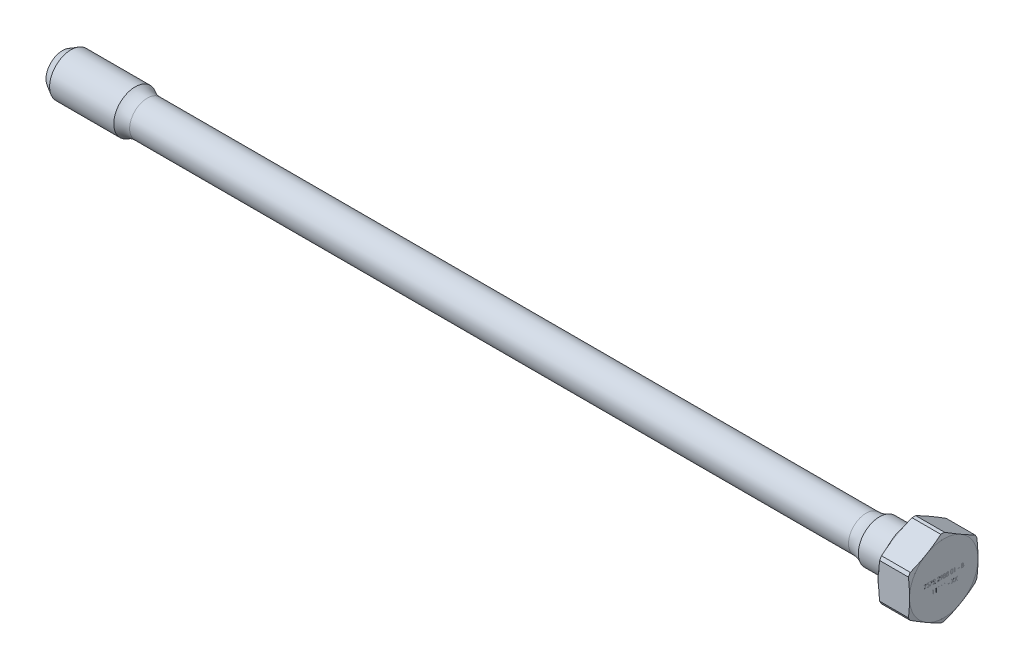
from build123d import *

# Parameters (mm, degrees)
CUT_EXTRUDE_THIN1_REACH = 414.786
SKETCH4_W               = 0.692307692
SKETCH4_H               = 0.184615385
CUT_EXTRUDE1_DEPTH      = 0.01


with BuildPart() as part:
    # Sketch1 → Revolve1 (revolve)
    with BuildSketch(Plane.XY):
        with BuildLine():
            Line((8, 0), (6.798278762, 2))
            Line((6.798278762, 2), (3.464101615, 2))
            Line((3.464101615, 2), (0, 4))
            Line((0, 4), (0, 7.690598923))
            Line((0, 7.690598923), (4, 10))
            Line((4, 10), (34, 10))
            ThreePointArc((34, 10), (36.693287386, 8.697513413), (39.651327278, 8.25))
            Line((39.651327278, 8.25), (375.706352409, 8.25))
            ThreePointArc((375.706352409, 8.25), (378.965953612, 8.682481614), (382, 9.95))
            Line((382, 9.95), (395, 9.95))
            ThreePointArc((395, 9.95), (396.414213562, 10.535786438), (397, 11.95))
            Line((397, 11.95), (397, 15.75))
            Line((397, 15.75), (397.5, 15.75))
            Line((397.5, 15.75), (397.5, 16))
            Line((397.5, 16), (398.035898385, 18))
            Line((398.035898385, 18), (411.464101615, 18))
            Line((411.464101615, 18), (412, 16))
            Line((412, 16), (412, 0))
            Line((412, 0), (8, 0))
        make_face()
    revolve(axis=Axis((412, 0, 0), (-1, 0, 0)))

    # Cut-Extrude-Thin1: up to this cone (the profile starts inside it)
    cut_extrude_thin1_end = Plane(origin=(412, 0, 0), z_dir=(1, 0, 0)).offset(-18.787186079) * Cone(3.732e-06, 1881.654948142, 504.187922789, align=(Align.CENTER, Align.CENTER, Align.MIN), mode=Mode.PRIVATE)
    # Sketch3 → Cut-Extrude-Thin1 (cut, up to the surface)
    with BuildSketch(Plane(origin=(412, 0, 0), x_dir=(0, 0, -1), z_dir=(1, 0, 0)), mode=Mode.PRIVATE) as cut_extrude_thin1_sk1:
        Polygon((0, 30.022213998), (-26, 15.011106999), (-26, -15.011106999), (0, -30.022213998), (26, -15.011106999), (26, 15.011106999), align=None)
        Polygon((0, 18.475208614), (-16, 9.237604307), (-16, -9.237604307), (0, -18.475208614), (16, -9.237604307), (16, 9.237604307), align=None, mode=Mode.SUBTRACT)
    cut_extrude_thin1_tool1 = extrude(cut_extrude_thin1_sk1.sketch, amount=-CUT_EXTRUDE_THIN1_REACH, mode=Mode.PRIVATE) & cut_extrude_thin1_end
    add(cut_extrude_thin1_tool1.solids().sort_by_distance((412, 21.828765, 12.602843))[0], mode=Mode.SUBTRACT)

    # Sketch4 → Cut-Extrude1 (cut)
    # profile 1 of 20: a face of its own
    with BuildSketch(Plane(origin=(412, 0, 0), x_dir=(0, 0, -1), z_dir=(-1, 0, 0))):
        Polygon((-9.191244791, -1.8), (-8.083552483, -1.8), (-9.02970633, 0.046153846), (-9.169249599, -0.030649038), (-8.357230368, -1.615384615), (-9.191244791, -1.615384615), align=None)
    # profile 2 of 20: a face of its own
    with BuildSketch(Plane(origin=(412, 0, 0), x_dir=(0, 0, -1), z_dir=(-1, 0, 0))):
        with BuildLine():
            Line((-7.691244791, -1.384615385), (-7.852783253, -1.384615385))
            add(Edge.make_bspline(
                [(-7.852783253, -1.384615385), (-7.848406912, -1.402734948), (-7.839851525, -1.438157212), (-7.822007059, -1.48876666), (-7.802567442, -1.536658757), (-7.779224474, -1.580936738), (-7.753762829, -1.622490459), (-7.724591143, -1.660377437), (-7.693055286, -1.695561248), (-7.658173883, -1.726785199), (-7.621593429, -1.75505946), (-7.582798481, -1.779166632), (-7.542569565, -1.799904768), (-7.500627954, -1.816989458), (-7.456848779, -1.829859728), (-7.41162783, -1.839197514), (-7.364846602, -1.845261515), (-7.333090698, -1.845853336), (-7.316965945, -1.846153846)],
                knots=[0, 0, 0, 0, 1.162005537, 2.271625781, 3.343758855, 4.383309926, 5.390229558, 6.379919256, 7.361854164, 8.333198761, 9.295911338, 10.242430842, 11.177959212, 12.116337295, 13.062827104, 14.020064771, 14.994644689, 16, 16, 16, 16], degree=3))
            add(Edge.make_bspline(
                [(-7.316965945, -1.846153846), (-7.293471963, -1.845444528), (-7.246996472, -1.844041363), (-7.178718334, -1.831228224), (-7.112875969, -1.810952442), (-7.050190071, -1.782937382), (-6.991963448, -1.748383907), (-6.940156266, -1.707259185), (-6.895470747, -1.660356687), (-6.857982209, -1.608551369), (-6.828629353, -1.553185678), (-6.806984932, -1.49620274), (-6.793808068, -1.437737726), (-6.792100353, -1.398262554), (-6.791244791, -1.378485577)],
                knots=[0, 0, 0, 0, 1.083050992, 2.142477498, 3.193116406, 4.255571735, 5.30263384, 6.308962982, 7.297363603, 8.282367274, 9.249857812, 10.179914175, 11.08814088, 12, 12, 12, 12], degree=3))
            add(Edge.make_bspline(
                [(-6.791244791, -1.378485577), (-6.791843209, -1.359453511), (-6.793014221, -1.322210712), (-6.80295727, -1.267839656), (-6.819690205, -1.216595404), (-6.84286894, -1.168262235), (-6.872873166, -1.123146603), (-6.909219124, -1.081147002), (-6.95216335, -1.04207715), (-6.984706804, -1.019695706), (-7.001461137, -1.008173077)],
                knots=[0, 0, 0, 0, 1.024540389, 2.004866551, 2.965041327, 3.920577974, 4.882998113, 5.874504559, 6.905732034, 8, 8, 8, 8], degree=3))
            add(Edge.make_bspline(
                [(-7.001461137, -1.008173077), (-6.982288971, -0.998960678), (-6.944241805, -0.980678671), (-6.892905073, -0.944255178), (-6.845591566, -0.903233283), (-6.819515849, -0.87086293), (-6.806389022, -0.854567308)],
                knots=[0, 0, 0, 0, 1.015663554, 2.015584519, 3.001021554, 4, 4, 4, 4], degree=3))
            add(Edge.make_bspline(
                [(-6.806389022, -0.854567308), (-6.797724235, -0.842710299), (-6.780536552, -0.819190449), (-6.759381213, -0.781353253), (-6.739969764, -0.743221934), (-6.7256835, -0.703297217), (-6.71335502, -0.662861556), (-6.70524329, -0.62104906), (-6.700035884, -0.578256985), (-6.699304658, -0.549294108), (-6.698937099, -0.534735577)],
                knots=[0, 0, 0, 0, 1.02516404, 2.033540309, 3.025129118, 4.011046665, 4.991655828, 5.976607087, 6.982917762, 8, 8, 8, 8], degree=3))
            add(Edge.make_bspline(
                [(-6.698937099, -0.534735577), (-6.699862156, -0.509531709), (-6.701707918, -0.459242583), (-6.718134684, -0.384924326), (-6.743758361, -0.312412067), (-6.779469204, -0.242734167), (-6.823852375, -0.177740147), (-6.876363704, -0.119420782), (-6.937059104, -0.069748369), (-7.004171387, -0.027877619), (-7.077162139, 0.005304479), (-7.154921289, 0.02921487), (-7.236988446, 0.043557751), (-7.293110464, 0.045278628), (-7.321653445, 0.046153846)],
                knots=[0, 0, 0, 0, 0.955619592, 1.906742024, 2.874954321, 3.868585453, 4.869520953, 5.854611167, 6.836527075, 7.836578462, 8.849204403, 9.870874567, 10.917152508, 12, 12, 12, 12], degree=3))
            add(Edge.make_bspline(
                [(-7.321653445, 0.046153846), (-7.340896445, 0.045703442), (-7.378760253, 0.044817197), (-7.434445589, 0.038866523), (-7.48748721, 0.027702625), (-7.538400169, 0.013662478), (-7.586416067, -0.005749598), (-7.632225568, -0.02889239), (-7.675627873, -0.056359362), (-7.716365228, -0.088196708), (-7.754394113, -0.123833855), (-7.788745677, -0.163862837), (-7.819799983, -0.207536574), (-7.847359716, -0.255247918), (-7.871540865, -0.306863238), (-7.891823049, -0.362589364), (-7.9095319, -0.421994283), (-7.917781418, -0.463380989), (-7.922014022, -0.484615385)],
                knots=[0, 0, 0, 0, 1.048603596, 2.063302207, 3.045874044, 3.999447474, 4.937100059, 5.862643889, 6.7929026, 7.7308982, 8.676022965, 9.627908155, 10.600123445, 11.591992905, 12.626222643, 13.701663232, 14.820785756, 16, 16, 16, 16], degree=3))
            Line((-7.922014022, -0.484615385), (-7.76047556, -0.484615385))
            add(Edge.make_bspline(
                [(-7.76047556, -0.484615385), (-7.756267011, -0.470755892), (-7.748081015, -0.443797975), (-7.734146805, -0.405000104), (-7.718271694, -0.369433105), (-7.701241349, -0.336836071), (-7.683355291, -0.306887978), (-7.663341901, -0.280380731), (-7.642683484, -0.256150056), (-7.627111245, -0.242498541), (-7.619489983, -0.235817308)],
                knots=[0, 0, 0, 0, 1.198163088, 2.33053128, 3.407730985, 4.417276592, 5.372219308, 6.28897303, 7.162600585, 8, 8, 8, 8], degree=3))
            add(Edge.make_bspline(
                [(-7.619489983, -0.235817308), (-7.609410618, -0.228050511), (-7.589283001, -0.212540893), (-7.556504805, -0.192691971), (-7.521911573, -0.175701768), (-7.485214821, -0.161891419), (-7.446409627, -0.151524873), (-7.405653402, -0.144063521), (-7.362879274, -0.139137869), (-7.333686768, -0.13869027), (-7.31876883, -0.138461538)],
                knots=[0, 0, 0, 0, 0.946083416, 1.889246487, 2.84504177, 3.809995578, 4.801312957, 5.829064617, 6.89060985, 8, 8, 8, 8], degree=3))
            add(Edge.make_bspline(
                [(-7.31876883, -0.138461538), (-7.301923943, -0.138777775), (-7.268985222, -0.139396147), (-7.220925908, -0.145099422), (-7.175190696, -0.153369348), (-7.132246312, -0.16630512), (-7.091508389, -0.181823716), (-7.053886315, -0.202140407), (-7.018274047, -0.225084824), (-6.985714861, -0.251773594), (-6.956361163, -0.280621266), (-6.930996325, -0.311226074), (-6.909027474, -0.342639072), (-6.891368184, -0.37559306), (-6.877398857, -0.409764787), (-6.867894862, -0.445282157), (-6.861285072, -0.481846093), (-6.860746874, -0.506701041), (-6.86047556, -0.519230769)],
                knots=[0, 0, 0, 0, 1.216990249, 2.379719373, 3.493992396, 4.571561497, 5.616923107, 6.638958652, 7.655775068, 8.674704564, 9.676001865, 10.625896028, 11.54399481, 12.441854662, 13.322657739, 14.20572845, 15.095482574, 16, 16, 16, 16], degree=3))
            add(Edge.make_bspline(
                [(-6.86047556, -0.519230769), (-6.861264215, -0.536001261), (-6.862837599, -0.569458797), (-6.874800272, -0.618700762), (-6.894653137, -0.666163542), (-6.921905899, -0.711225572), (-6.955875992, -0.752500767), (-6.994957653, -0.789446516), (-7.039984762, -0.820209536), (-7.081662308, -0.841404855), (-7.118674888, -0.855526459), (-7.150285509, -0.865428966), (-7.185706193, -0.873344661), (-7.224511334, -0.88100159), (-7.266864712, -0.887420655), (-7.312804448, -0.892796879), (-7.362349035, -0.897091944), (-7.39664728, -0.899011053), (-7.414321714, -0.9)],
                knots=[0, 0, 0, 0, 1.070440979, 2.135555593, 3.216243406, 4.345886539, 5.486149072, 6.621334998, 7.769144672, 8.957074012, 9.598644492, 10.297969361, 11.070758978, 11.915404831, 12.824182859, 13.805940418, 14.869366021, 16, 16, 16, 16], degree=3))
            Line((-7.414321714, -0.9), (-7.414321714, -1.084615385))
            add(Edge.make_bspline(
                [(-7.414321714, -1.084615385), (-7.392061204, -1.085049391), (-7.348473582, -1.085899206), (-7.284624228, -1.094060967), (-7.223755842, -1.107308659), (-7.166783973, -1.125804157), (-7.115124747, -1.148320964), (-7.069878597, -1.173531186), (-7.032673262, -1.20261518), (-7.00284239, -1.234198105), (-6.980716509, -1.268286621), (-6.96438449, -1.303654314), (-6.954724445, -1.340959147), (-6.953432595, -1.366412644), (-6.952783253, -1.379206731)],
                knots=[0, 0, 0, 0, 1.321816535, 2.58820849, 3.816448615, 5.017641336, 6.139869627, 7.160068286, 8.085608132, 8.934319198, 9.728416342, 10.48890201, 11.240453369, 12, 12, 12, 12], degree=3))
            add(Edge.make_bspline(
                [(-6.952783253, -1.379206731), (-6.952991689, -1.388608301), (-6.953406364, -1.407312278), (-6.958844809, -1.434723705), (-6.9666395, -1.461297531), (-6.977963607, -1.486723259), (-6.992609121, -1.511081715), (-7.010328011, -1.534461865), (-7.031165163, -1.557086967), (-7.054985264, -1.578458027), (-7.081569107, -1.597692359), (-7.10984972, -1.614839498), (-7.139937359, -1.629257801), (-7.171635949, -1.641209595), (-7.205116837, -1.650184395), (-7.240203888, -1.656632593), (-7.276969231, -1.660663055), (-7.302051802, -1.661243429), (-7.314802483, -1.661538462)],
                knots=[0, 0, 0, 0, 0.884246871, 1.759167212, 2.622361933, 3.489113179, 4.372562419, 5.294145153, 6.247651513, 7.265905295, 8.30305477, 9.334068495, 10.37719476, 11.441246459, 12.52060732, 13.637552802, 14.799054011, 16, 16, 16, 16], degree=3))
            add(Edge.make_bspline(
                [(-7.314802483, -1.661538462), (-7.335298304, -1.660824292), (-7.375331409, -1.659429353), (-7.433032502, -1.647168464), (-7.486618104, -1.627742351), (-7.527439525, -1.604285376), (-7.55763465, -1.581209997), (-7.579625493, -1.561358249), (-7.600826917, -1.538850432), (-7.620406961, -1.513069183), (-7.639538902, -1.484901015), (-7.658040058, -1.454190787), (-7.675316172, -1.420500664), (-7.685832426, -1.396808798), (-7.691244791, -1.384615385)],
                knots=[0, 0, 0, 0, 1.4727372, 2.876598283, 4.222346151, 5.558423782, 6.24313385, 6.953189256, 7.68715613, 8.463578749, 9.278833271, 10.135787152, 11.040551781, 12, 12, 12, 12], degree=3))
        make_face()
    # profile 3 of 20: a face of its own
    with BuildSketch(Plane(origin=(412, 0, 0), x_dir=(0, 0, -1), z_dir=(-1, 0, 0))):
        Polygon((-6.422014022, -1.8), (-5.314321714, -1.8), (-6.26047556, 0.046153846), (-6.40001883, -0.030649038), (-5.587999599, -1.615384615), (-6.422014022, -1.615384615), align=None)
    # profile 4 of 20: a face of its own
    with BuildSketch(Plane(origin=(412, 0, 0), x_dir=(0, 0, -1), z_dir=(-1, 0, 0))):
        with BuildLine():
            Line((-4.922014022, -1.246153846), (-5.083552483, -1.246153846))
            add(Edge.make_bspline(
                [(-5.083552483, -1.246153846), (-5.082499841, -1.267584694), (-5.08043248, -1.309674309), (-5.070746824, -1.371039395), (-5.056900693, -1.429701558), (-5.037277495, -1.48515788), (-5.013044561, -1.538070831), (-4.983376436, -1.58773779), (-4.948905598, -1.634651694), (-4.909695284, -1.677924309), (-4.86714848, -1.717480889), (-4.821520107, -1.752001503), (-4.773279139, -1.780834341), (-4.722843996, -1.805069006), (-4.669631382, -1.823237977), (-4.61414995, -1.836724977), (-4.55614893, -1.844838094), (-4.516631248, -1.845710272), (-4.496533253, -1.846153846)],
                knots=[0, 0, 0, 0, 1.100776268, 2.161895295, 3.184016182, 4.190939212, 5.176500551, 6.166955529, 7.155448256, 8.160289653, 9.16017456, 10.133824356, 11.091467644, 12.04088621, 13.000931625, 13.972173743, 14.968683325, 16, 16, 16, 16], degree=3))
            add(Edge.make_bspline(
                [(-4.496533253, -1.846153846), (-4.476794568, -1.845695533), (-4.438008759, -1.844794963), (-4.381425087, -1.836944817), (-4.327430693, -1.824915168), (-4.276637495, -1.807089124), (-4.228524214, -1.784721338), (-4.183686569, -1.756904065), (-4.141040342, -1.724953525), (-4.102678534, -1.687266297), (-4.067438585, -1.64705393), (-4.03706388, -1.604107459), (-4.010904945, -1.559699486), (-3.989494674, -1.51348312), (-3.973264736, -1.465307858), (-3.961239908, -1.415635572), (-3.954365866, -1.363893011), (-3.953316671, -1.328865775), (-3.952783253, -1.311057692)],
                knots=[0, 0, 0, 0, 1.111674182, 2.184400057, 3.212814286, 4.223731311, 5.211378316, 6.196328225, 7.191884489, 8.207283132, 9.220262353, 10.201199469, 11.166417575, 12.120932471, 13.06540007, 14.026332106, 14.996573967, 16, 16, 16, 16], degree=3))
            add(Edge.make_bspline(
                [(-3.952783253, -1.311057692), (-3.953655564, -1.285987963), (-3.955384878, -1.236288443), (-3.97013043, -1.163243641), (-3.99326123, -1.092563643), (-4.020777281, -1.035458466), (-4.048430798, -0.989394593), (-4.074004113, -0.951822035), (-4.103539637, -0.911145427), (-4.137472344, -0.867408528), (-4.176314782, -0.821169673), (-4.218585241, -0.771186594), (-4.266148841, -0.719039074), (-4.29938383, -0.683380978), (-4.316605368, -0.664903846)],
                knots=[0, 0, 0, 0, 1.184219417, 2.34765746, 3.508456027, 4.692825395, 5.335023057, 6.047372803, 6.840716919, 7.711366838, 8.663720231, 9.695456184, 10.805843131, 12, 12, 12, 12], degree=3))
            Line((-4.316605368, -0.664903846), (-4.766965945, -0.184615385))
            Line((-4.766965945, -0.184615385), (-3.92970633, -0.184615385))
            Line((-3.92970633, -0.184615385), (-3.92970633, 0))
            Line((-3.92970633, 0), (-5.152783253, 0))
            Line((-5.152783253, 0), (-4.45470633, -0.744951923))
            add(Edge.make_bspline(
                [(-4.45470633, -0.744951923), (-4.43770907, -0.762692942), (-4.405060814, -0.796769807), (-4.358902748, -0.846536061), (-4.317378698, -0.892650691), (-4.280461117, -0.935318042), (-4.24811963, -0.97429623), (-4.220457716, -1.009890718), (-4.197353114, -1.041796045), (-4.17286705, -1.079277089), (-4.149517964, -1.125093533), (-4.128996506, -1.180801987), (-4.116573095, -1.238276292), (-4.115075179, -1.277103964), (-4.114321714, -1.296634615)],
                knots=[0, 0, 0, 0, 1.329530082, 2.553755191, 3.672934919, 4.687409497, 5.60679272, 6.413407421, 7.126401618, 7.737995624, 8.834647426, 9.90044882, 10.943907757, 12, 12, 12, 12], degree=3))
            add(Edge.make_bspline(
                [(-4.114321714, -1.296634615), (-4.114645309, -1.308917835), (-4.115283052, -1.333125701), (-4.121018056, -1.368594904), (-4.129443914, -1.402941748), (-4.142430765, -1.43574156), (-4.158033989, -1.467639448), (-4.177968257, -1.497665618), (-4.200747891, -1.526843589), (-4.227171149, -1.554172872), (-4.256178977, -1.57921074), (-4.286828443, -1.601388366), (-4.319253951, -1.61992289), (-4.35332037, -1.635116655), (-4.388932306, -1.647035431), (-4.426158752, -1.655294127), (-4.464896816, -1.660479405), (-4.491348328, -1.661180979), (-4.504826522, -1.661538462)],
                knots=[0, 0, 0, 0, 0.991504627, 1.954065223, 2.895985987, 3.842598665, 4.797835564, 5.759220273, 6.74786863, 7.784730864, 8.824135544, 9.839918996, 10.835834653, 11.835434876, 12.84861661, 13.863796685, 14.911511676, 16, 16, 16, 16], degree=3))
            add(Edge.make_bspline(
                [(-4.504826522, -1.661538462), (-4.518906546, -1.661185352), (-4.546557388, -1.660491904), (-4.587067707, -1.65523614), (-4.625983718, -1.647276553), (-4.662705735, -1.634604956), (-4.698002285, -1.619774507), (-4.730972937, -1.600571685), (-4.762543875, -1.57862949), (-4.792080358, -1.553046285), (-4.818981711, -1.5241667), (-4.843454113, -1.492731782), (-4.864189821, -1.458184254), (-4.882596701, -1.421353093), (-4.896674329, -1.381226396), (-4.908709693, -1.338785509), (-4.917452007, -1.293424902), (-4.920468093, -1.262172573), (-4.922014022, -1.246153846)],
                knots=[0, 0, 0, 0, 1.031072318, 2.024855787, 2.988461151, 3.935103592, 4.865765533, 5.788564469, 6.724086513, 7.67908574, 8.64457978, 9.611397706, 10.591395687, 11.591555111, 12.622101007, 13.700900657, 14.821571223, 16, 16, 16, 16], degree=3))
        make_face()
    # profile 5 of 20: a face of its own
    with BuildSketch(Plane(origin=(412, 0, 0), x_dir=(0, 0, -1), z_dir=(-1, 0, 0))):
        with BuildLine():
            Line((-2.845090945, -1.246153846), (-3.006629407, -1.246153846))
            add(Edge.make_bspline(
                [(-3.006629407, -1.246153846), (-3.005576764, -1.267584694), (-3.003509403, -1.309674309), (-2.993823747, -1.371039395), (-2.979977616, -1.429701558), (-2.960354418, -1.48515788), (-2.936121484, -1.538070831), (-2.906453359, -1.58773779), (-2.871982521, -1.634651694), (-2.832772208, -1.677924309), (-2.790225403, -1.717480889), (-2.74459703, -1.752001503), (-2.696356062, -1.780834341), (-2.645920919, -1.805069006), (-2.592708306, -1.823237977), (-2.537226873, -1.836724977), (-2.479225853, -1.844838094), (-2.439708172, -1.845710272), (-2.419610176, -1.846153846)],
                knots=[0, 0, 0, 0, 1.100776268, 2.161895295, 3.184016182, 4.190939212, 5.176500551, 6.166955529, 7.155448256, 8.160289653, 9.16017456, 10.133824356, 11.091467644, 12.04088621, 13.000931625, 13.972173743, 14.968683325, 16, 16, 16, 16], degree=3))
            add(Edge.make_bspline(
                [(-2.419610176, -1.846153846), (-2.399871492, -1.845695533), (-2.361085682, -1.844794963), (-2.30450201, -1.836944817), (-2.250507616, -1.824915168), (-2.199714419, -1.807089124), (-2.151601137, -1.784721338), (-2.106763492, -1.756904065), (-2.064117265, -1.724953525), (-2.025755457, -1.687266297), (-1.990515508, -1.64705393), (-1.960140803, -1.604107459), (-1.933981868, -1.559699486), (-1.912571597, -1.51348312), (-1.896341659, -1.465307858), (-1.884316831, -1.415635572), (-1.877442789, -1.363893011), (-1.876393594, -1.328865775), (-1.875860176, -1.311057692)],
                knots=[0, 0, 0, 0, 1.111674182, 2.184400057, 3.212814286, 4.223731311, 5.211378316, 6.196328225, 7.191884489, 8.207283132, 9.220262353, 10.201199469, 11.166417575, 12.120932471, 13.06540007, 14.026332106, 14.996573967, 16, 16, 16, 16], degree=3))
            add(Edge.make_bspline(
                [(-1.875860176, -1.311057692), (-1.876732487, -1.285987963), (-1.878461801, -1.236288443), (-1.893207353, -1.163243641), (-1.916338153, -1.092563643), (-1.943854204, -1.035458466), (-1.971507721, -0.989394593), (-1.997081036, -0.951822035), (-2.026616561, -0.911145427), (-2.060549267, -0.867408528), (-2.099391705, -0.821169673), (-2.141662164, -0.771186594), (-2.189225764, -0.719039074), (-2.222460753, -0.683380978), (-2.239682291, -0.664903846)],
                knots=[0, 0, 0, 0, 1.184219417, 2.34765746, 3.508456027, 4.692825395, 5.335023057, 6.047372803, 6.840716919, 7.711366838, 8.663720231, 9.695456184, 10.805843131, 12, 12, 12, 12], degree=3))
            Line((-2.239682291, -0.664903846), (-2.690042868, -0.184615385))
            Line((-2.690042868, -0.184615385), (-1.852783253, -0.184615385))
            Line((-1.852783253, -0.184615385), (-1.852783253, 0))
            Line((-1.852783253, 0), (-3.075860176, 0))
            Line((-3.075860176, 0), (-2.377783253, -0.744951923))
            add(Edge.make_bspline(
                [(-2.377783253, -0.744951923), (-2.360785993, -0.762692942), (-2.328137737, -0.796769807), (-2.281979671, -0.846536061), (-2.240455621, -0.892650691), (-2.20353804, -0.935318042), (-2.171196553, -0.97429623), (-2.143534639, -1.009890718), (-2.120430037, -1.041796045), (-2.095943974, -1.079277089), (-2.072594887, -1.125093533), (-2.052073429, -1.180801987), (-2.039650018, -1.238276292), (-2.038152102, -1.277103964), (-2.037398637, -1.296634615)],
                knots=[0, 0, 0, 0, 1.329530082, 2.553755191, 3.672934919, 4.687409497, 5.60679272, 6.413407421, 7.126401618, 7.737995624, 8.834647426, 9.90044882, 10.943907757, 12, 12, 12, 12], degree=3))
            add(Edge.make_bspline(
                [(-2.037398637, -1.296634615), (-2.037722232, -1.308917835), (-2.038359975, -1.333125701), (-2.044094979, -1.368594904), (-2.052520837, -1.402941748), (-2.065507688, -1.43574156), (-2.081110912, -1.467639448), (-2.10104518, -1.497665618), (-2.123824814, -1.526843589), (-2.150248072, -1.554172872), (-2.1792559, -1.57921074), (-2.209905366, -1.601388366), (-2.242330874, -1.61992289), (-2.276397293, -1.635116655), (-2.312009229, -1.647035431), (-2.349235675, -1.655294127), (-2.387973739, -1.660479405), (-2.414425251, -1.661180979), (-2.427903445, -1.661538462)],
                knots=[0, 0, 0, 0, 0.991504627, 1.954065223, 2.895985987, 3.842598665, 4.797835564, 5.759220273, 6.74786863, 7.784730864, 8.824135544, 9.839918996, 10.835834653, 11.835434876, 12.84861661, 13.863796685, 14.911511676, 16, 16, 16, 16], degree=3))
            add(Edge.make_bspline(
                [(-2.427903445, -1.661538462), (-2.441983469, -1.661185352), (-2.469634311, -1.660491904), (-2.51014463, -1.65523614), (-2.549060641, -1.647276553), (-2.585782658, -1.634604956), (-2.621079208, -1.619774507), (-2.65404986, -1.600571685), (-2.685620798, -1.57862949), (-2.715157281, -1.553046285), (-2.742058634, -1.5241667), (-2.766531036, -1.492731782), (-2.787266744, -1.458184254), (-2.805673624, -1.421353093), (-2.819751252, -1.381226396), (-2.831786616, -1.338785509), (-2.84052893, -1.293424902), (-2.843545016, -1.262172573), (-2.845090945, -1.246153846)],
                knots=[0, 0, 0, 0, 1.031072318, 2.024855787, 2.988461151, 3.935103592, 4.865765533, 5.788564469, 6.724086513, 7.67908574, 8.64457978, 9.611397706, 10.591395687, 11.591555111, 12.622101007, 13.700900657, 14.821571223, 16, 16, 16, 16], degree=3))
        make_face()
    # profile 6 of 20: a face of its own
    with BuildSketch(Plane(origin=(412, 0, 0), x_dir=(0, 0, -1), z_dir=(-1, 0, 0))):
        with BuildLine():
            Line((-1.298937099, 0.046153846), (-1.428023637, -0.043629808))
            Line((-1.428023637, -0.043629808), (-0.927542868, -0.775240385))
            add(Edge.make_bspline(
                [(-0.927542868, -0.775240385), (-0.959470832, -0.771153166), (-1.02232208, -0.763107343), (-1.08567543, -0.762055819), (-1.116845753, -0.761538462)],
                knots=[0, 0, 0, 0, 1.015985029, 2, 2, 2, 2], degree=3))
            add(Edge.make_bspline(
                [(-1.116845753, -0.761538462), (-1.13574114, -0.762023879), (-1.172831134, -0.762976711), (-1.227369132, -0.770486371), (-1.279851284, -0.782183545), (-1.330077695, -0.799232971), (-1.378003576, -0.821022604), (-1.42379634, -0.847565152), (-1.467394696, -0.878959722), (-1.508288125, -0.914867688), (-1.545470568, -0.954306275), (-1.578623726, -0.996033311), (-1.606026342, -1.040501542), (-1.629196139, -1.086772527), (-1.646274991, -1.135834029), (-1.659012427, -1.186853523), (-1.666768442, -1.240147719), (-1.667696605, -1.276416658), (-1.668167868, -1.294831731)],
                knots=[0, 0, 0, 0, 1.060682839, 2.082027659, 3.085691555, 4.076014095, 5.054630121, 6.037449673, 7.043289733, 8.066773124, 9.088474683, 10.083546559, 11.053653938, 12.01652662, 12.983553501, 13.964076119, 14.966286614, 16, 16, 16, 16], degree=3))
            add(Edge.make_bspline(
                [(-1.668167868, -1.294831731), (-1.66727408, -1.320014638), (-1.665519756, -1.369443577), (-1.651454603, -1.441680476), (-1.628151241, -1.510021357), (-1.596168587, -1.5743898), (-1.55511305, -1.633307262), (-1.506356558, -1.686574127), (-1.449505048, -1.733240192), (-1.386042817, -1.773308501), (-1.317551852, -1.80575337), (-1.245522999, -1.828804067), (-1.171169628, -1.843529391), (-1.120639827, -1.845275255), (-1.095211137, -1.846153846)],
                knots=[0, 0, 0, 0, 1.023011052, 2.007963168, 2.978169221, 3.950402619, 4.919353283, 5.887490769, 6.876420893, 7.899700203, 8.931203047, 9.947778163, 10.96723692, 12, 12, 12, 12], degree=3))
            add(Edge.make_bspline(
                [(-1.095211137, -1.846153846), (-1.070273272, -1.845215997), (-1.020998401, -1.843362894), (-0.948442547, -1.829672294), (-0.878888668, -1.806843717), (-0.812881293, -1.775152568), (-0.752089326, -1.735165766), (-0.697184445, -1.687930006), (-0.649841536, -1.632902895), (-0.609464366, -1.571770237), (-0.57765999, -1.505675253), (-0.554354568, -1.436817008), (-0.540109002, -1.365607557), (-0.538307706, -1.31737207), (-0.537398637, -1.293028846)],
                knots=[0, 0, 0, 0, 1.026310256, 2.027892329, 3.027798401, 4.032590076, 5.033095916, 6.015299856, 7.004484051, 8.011843335, 9.023241558, 10.015317641, 10.998381257, 12, 12, 12, 12], degree=3))
            add(Edge.make_bspline(
                [(-0.537398637, -1.293028846), (-0.537999821, -1.274131201), (-0.539219172, -1.235802056), (-0.547881718, -1.177726419), (-0.562132924, -1.118433843), (-0.578407372, -1.068137572), (-0.595322711, -1.026889426), (-0.609451184, -0.993693125), (-0.626678718, -0.959286833), (-0.646284541, -0.923421742), (-0.667303603, -0.885575417), (-0.690998023, -0.846451752), (-0.716867517, -0.805829586), (-0.735294504, -0.778445554), (-0.744730368, -0.764423077)],
                knots=[0, 0, 0, 0, 1.179744101, 2.39281581, 3.657884751, 4.98449437, 5.688244212, 6.441097573, 7.23650985, 8.089392143, 8.993247458, 9.939208743, 10.944735416, 12, 12, 12, 12], degree=3))
            Line((-0.744730368, -0.764423077), (-1.298937099, 0.046153846))
        make_face()
        with BuildLine():
            add(Edge.make_bspline(
                [(-1.086917868, -0.946153846), (-1.072603576, -0.946545711), (-1.044738516, -0.947308538), (-1.003911137, -0.951930626), (-0.965395854, -0.960186275), (-0.928944779, -0.971844403), (-0.894602039, -0.986612925), (-0.862356817, -1.004610786), (-0.832538485, -1.026232281), (-0.805040882, -1.050535275), (-0.780085972, -1.077170391), (-0.758569088, -1.105707444), (-0.73993936, -1.135259887), (-0.725077003, -1.166432701), (-0.713099463, -1.198715934), (-0.704741955, -1.232576466), (-0.700125989, -1.267780508), (-0.699337696, -1.291693827), (-0.698937099, -1.303846154)],
                knots=[0, 0, 0, 0, 1.163726718, 2.265380301, 3.334713825, 4.36057981, 5.371541381, 6.368955992, 7.355979581, 8.359691305, 9.348261197, 10.317521986, 11.261029684, 12.183096459, 13.119698615, 14.055740009, 15.011961376, 16, 16, 16, 16], degree=3))
            add(Edge.make_bspline(
                [(-0.698937099, -1.303846154), (-0.699281135, -1.316003889), (-0.699959101, -1.339962198), (-0.705409243, -1.375213573), (-0.714968407, -1.409009015), (-0.727932804, -1.441569956), (-0.744655634, -1.472750864), (-0.764993005, -1.502461306), (-0.789076384, -1.53081058), (-0.816518258, -1.557443479), (-0.846630891, -1.581916363), (-0.878820339, -1.603154932), (-0.912380864, -1.621410256), (-0.947693829, -1.635702372), (-0.984279976, -1.647434514), (-1.022541705, -1.655734044), (-1.062525454, -1.660359229), (-1.089670772, -1.661140377), (-1.103504407, -1.661538462)],
                knots=[0, 0, 0, 0, 0.97180342, 1.915057841, 2.843062057, 3.774592458, 4.711855407, 5.666109401, 6.64802866, 7.681008178, 8.719604906, 9.745767187, 10.760480799, 11.768803314, 12.78696958, 13.829338598, 14.893800474, 16, 16, 16, 16], degree=3))
            add(Edge.make_bspline(
                [(-1.103504407, -1.661538462), (-1.117217765, -1.661139797), (-1.144123261, -1.660357619), (-1.183751077, -1.655742103), (-1.221755861, -1.647381136), (-1.2582291, -1.6356966), (-1.293467582, -1.621489815), (-1.326760959, -1.603155361), (-1.358615006, -1.581802986), (-1.388718935, -1.557475002), (-1.416100741, -1.530682552), (-1.440601429, -1.502587621), (-1.460892222, -1.472734857), (-1.477638627, -1.441574184), (-1.490596789, -1.409007891), (-1.500157617, -1.375213877), (-1.505607312, -1.339962119), (-1.506285339, -1.316003863), (-1.506629407, -1.303846154)],
                knots=[0, 0, 0, 0, 1.099260809, 2.156740654, 3.192227907, 4.212865946, 5.223636336, 6.232338816, 7.252976855, 8.294094955, 9.329582207, 10.320135147, 11.276705756, 12.216244072, 13.150035923, 14.080293028, 15.025837361, 16, 16, 16, 16], degree=3))
            add(Edge.make_bspline(
                [(-1.506629407, -1.303846154), (-1.506317449, -1.2916844), (-1.505702211, -1.267699195), (-1.49977851, -1.232454504), (-1.489845785, -1.198681498), (-1.476674939, -1.166091878), (-1.458999283, -1.13510727), (-1.437518251, -1.105567004), (-1.412732806, -1.076867169), (-1.383830675, -1.050618556), (-1.352794785, -1.026115962), (-1.319458933, -1.004746733), (-1.284493021, -0.986827977), (-1.248121554, -0.971800869), (-1.210072376, -0.960303872), (-1.17039847, -0.951945961), (-1.129092691, -0.947352851), (-1.101111019, -0.946557349), (-1.086917868, -0.946153846)],
                knots=[0, 0, 0, 0, 0.952872936, 1.879239831, 2.791748947, 3.708674669, 4.628500839, 5.580394867, 6.568761142, 7.595635223, 8.636123962, 9.665976811, 10.694276597, 11.712685318, 12.747011694, 13.805940053, 14.887106426, 16, 16, 16, 16], degree=3))
        make_face(mode=Mode.SUBTRACT)
    # profile 7 of 20: a face of its own
    with BuildSketch(Plane(origin=(412, 0, 0), x_dir=(0, 0, -1), z_dir=(-1, 0, 0))):
        with BuildLine():
            add(Edge.make_bspline(
                [(0.568490786, -1.002764423), (0.583107047, -0.995083435), (0.611702808, -0.980056083), (0.652438551, -0.955786441), (0.690458902, -0.931092929), (0.72506065, -0.905087716), (0.756583031, -0.878323581), (0.78512305, -0.850871346), (0.810987639, -0.822817829), (0.833288234, -0.793441829), (0.853074597, -0.763265738), (0.869836074, -0.73191764), (0.884464586, -0.699850523), (0.895946146, -0.666577542), (0.905425489, -0.632555155), (0.911942941, -0.597326838), (0.91544917, -0.561129388), (0.916111936, -0.536665662), (0.916447517, -0.524278846)],
                knots=[0, 0, 0, 0, 1.264219729, 2.473363326, 3.62979159, 4.734286947, 5.785533755, 6.79450939, 7.765315851, 8.704182021, 9.615576613, 10.525715488, 11.423813905, 12.311666436, 13.218214638, 14.126256791, 15.051260205, 16, 16, 16, 16], degree=3))
            add(Edge.make_bspline(
                [(0.916447517, -0.524278846), (0.91605301, -0.506947837), (0.915272132, -0.472643267), (0.908399811, -0.422024695), (0.898248484, -0.372664714), (0.882827646, -0.325122876), (0.863851573, -0.278994116), (0.839906276, -0.234899911), (0.812880909, -0.191574521), (0.791146834, -0.164926267), (0.78014944, -0.151442308)],
                knots=[0, 0, 0, 0, 1.02531512, 2.029483338, 3.018748588, 4.004195107, 4.983200899, 5.966616707, 6.971112471, 8, 8, 8, 8], degree=3))
            add(Edge.make_bspline(
                [(0.78014944, -0.151442308), (0.765833539, -0.135708367), (0.737378642, -0.104434913), (0.688633136, -0.06383164), (0.635136167, -0.029709094), (0.577094739, -0.001900691), (0.514664001, 0.019743465), (0.447857256, 0.03529676), (0.376544263, 0.044205438), (0.327530021, 0.045493204), (0.302385017, 0.046153846)],
                knots=[0, 0, 0, 0, 0.954267603, 1.896743057, 2.838368354, 3.796610408, 4.779680527, 5.799409237, 6.871065594, 8, 8, 8, 8], degree=3))
            add(Edge.make_bspline(
                [(0.302385017, 0.046153846), (0.278207259, 0.045559553), (0.231159799, 0.044403118), (0.162670939, 0.036610737), (0.098751056, 0.022815243), (0.039097092, 0.004323735), (-0.015714119, -0.020335131), (-0.065782232, -0.050559702), (-0.111841089, -0.085667608), (-0.152445765, -0.126503758), (-0.188484653, -0.170251732), (-0.220169908, -0.215371227), (-0.246357671, -0.261829401), (-0.268929419, -0.308919579), (-0.28572718, -0.357595908), (-0.297641262, -0.407358856), (-0.305124967, -0.458067053), (-0.306125875, -0.492282353), (-0.306629407, -0.509495192)],
                knots=[0, 0, 0, 0, 1.256864279, 2.445730223, 3.576845088, 4.651810441, 5.686528262, 6.692706664, 7.686234615, 8.689148594, 9.678739427, 10.630299996, 11.55097961, 12.448208961, 13.341360817, 14.221834469, 15.105450545, 16, 16, 16, 16], degree=3))
            add(Edge.make_bspline(
                [(-0.306629407, -0.509495192), (-0.306332138, -0.522125606), (-0.30574463, -0.54708776), (-0.301680332, -0.583967254), (-0.295140652, -0.619860886), (-0.286278785, -0.654910331), (-0.274158634, -0.688930652), (-0.259779811, -0.722097296), (-0.242852486, -0.754409302), (-0.222710107, -0.785374728), (-0.200518427, -0.816090445), (-0.17417486, -0.845031275), (-0.145435719, -0.873897164), (-0.112590152, -0.900932778), (-0.077412062, -0.92837164), (-0.038260825, -0.953920345), (0.003558098, -0.979572846), (0.033288017, -0.994901258), (0.048538863, -1.002764423)],
                knots=[0, 0, 0, 0, 0.941575622, 1.860885767, 2.762557628, 3.660168386, 4.552890429, 5.45184204, 6.353736508, 7.268493418, 8.204037487, 9.175167802, 10.182660057, 11.238220596, 12.344046335, 13.507168087, 14.721227736, 16, 16, 16, 16], degree=3))
            add(Edge.make_bspline(
                [(0.048538863, -1.002764423), (0.027688713, -1.014181083), (-0.012619882, -1.036252366), (-0.066502719, -1.07629761), (-0.112146038, -1.120454945), (-0.149064773, -1.16879082), (-0.178213983, -1.219716604), (-0.198822808, -1.272964201), (-0.212274658, -1.327939721), (-0.213637343, -1.365427568), (-0.214321714, -1.384254808)],
                knots=[0, 0, 0, 0, 1.16701039, 2.256125286, 3.287752239, 4.277689688, 5.235169525, 6.160862735, 7.076343936, 8, 8, 8, 8], degree=3))
            add(Edge.make_bspline(
                [(-0.214321714, -1.384254808), (-0.213479147, -1.403435524), (-0.21178544, -1.441992109), (-0.198136989, -1.499403172), (-0.175726952, -1.55582094), (-0.145768069, -1.611114672), (-0.107641687, -1.662764853), (-0.062513787, -1.709464051), (-0.010441133, -1.750003643), (0.047431732, -1.784272923), (0.109599757, -1.812297636), (0.175303192, -1.831429687), (0.243371042, -1.844012853), (0.289707878, -1.845433518), (0.313202324, -1.846153846)],
                knots=[0, 0, 0, 0, 0.888724595, 1.786491426, 2.720083884, 3.697804067, 4.69440576, 5.687697823, 6.7000873, 7.744853364, 8.800284131, 9.853047784, 10.91141782, 12, 12, 12, 12], degree=3))
            add(Edge.make_bspline(
                [(0.313202324, -1.846153846), (0.336090855, -1.845413226), (0.381224429, -1.843952809), (0.447665224, -1.831652226), (0.511291014, -1.811338567), (0.571745201, -1.78367129), (0.627741451, -1.749197053), (0.67757293, -1.708211327), (0.721646439, -1.662020971), (0.758059113, -1.610200438), (0.787269768, -1.554910393), (0.808304805, -1.497556362), (0.821603326, -1.438825933), (0.823293173, -1.399106878), (0.824139824, -1.379206731)],
                knots=[0, 0, 0, 0, 1.072634126, 2.115112298, 3.156050586, 4.19761425, 5.225177188, 6.230426315, 7.215180151, 8.209739481, 9.190420596, 10.139012357, 11.067603024, 12, 12, 12, 12], degree=3))
            add(Edge.make_bspline(
                [(0.824139824, -1.379206731), (0.823397587, -1.35967759), (0.821939875, -1.321323466), (0.809838849, -1.265492601), (0.789142335, -1.213314117), (0.761222674, -1.163985101), (0.724577482, -1.118293828), (0.67994666, -1.076013379), (0.627909345, -1.036316837), (0.588739702, -1.014198562), (0.568490786, -1.002764423)],
                knots=[0, 0, 0, 0, 0.975463758, 1.915755378, 2.838359076, 3.772025586, 4.738400888, 5.753889765, 6.838863581, 8, 8, 8, 8], degree=3))
        make_face()
        with BuildLine():
            add(Edge.make_bspline(
                [(0.304187901, -1.661538462), (0.291561331, -1.661204519), (0.266858239, -1.660551183), (0.23064396, -1.65711155), (0.196178791, -1.650504554), (0.163274263, -1.641453058), (0.131817657, -1.630191184), (0.10253033, -1.615353282), (0.074428061, -1.598860891), (0.048432769, -1.579516068), (0.02490043, -1.558410447), (0.003881902, -1.536368951), (-0.013241675, -1.512741806), (-0.027973715, -1.488711045), (-0.038914313, -1.463279935), (-0.046686137, -1.437005296), (-0.052186317, -1.409720707), (-0.052582728, -1.391133262), (-0.052783253, -1.381730769)],
                knots=[0, 0, 0, 0, 1.20353747, 2.354645537, 3.462130888, 4.543058862, 5.604822423, 6.639552563, 7.666902586, 8.706944258, 9.720926464, 10.677177239, 11.602682187, 12.496457588, 13.358248655, 14.231532794, 15.105417644, 16, 16, 16, 16], degree=3))
            add(Edge.make_bspline(
                [(-0.052783253, -1.381730769), (-0.052417542, -1.3723336), (-0.051694845, -1.353763444), (-0.046463938, -1.326230596), (-0.037717818, -1.299526385), (-0.025725007, -1.273401523), (-0.010334479, -1.247923065), (0.008345026, -1.22299338), (0.031124007, -1.199271713), (0.056278875, -1.176085036), (0.083756118, -1.154722807), (0.112629702, -1.135640894), (0.143110348, -1.120428962), (0.174285232, -1.107091206), (0.206813629, -1.097086343), (0.240471253, -1.089878428), (0.27522215, -1.085419883), (0.29876605, -1.084885673), (0.310678286, -1.084615385)],
                knots=[0, 0, 0, 0, 0.873213166, 1.72559466, 2.594724523, 3.479581045, 4.391597569, 5.35687048, 6.368548091, 7.443976143, 8.534559525, 9.600545123, 10.654815915, 11.696401765, 12.749428718, 13.812189468, 14.893058657, 16, 16, 16, 16], degree=3))
            add(Edge.make_bspline(
                [(0.310678286, -1.084615385), (0.325979255, -1.085062024), (0.356430067, -1.085950891), (0.401303035, -1.094290684), (0.445043811, -1.107243171), (0.486824745, -1.125626885), (0.525898057, -1.14804105), (0.561161719, -1.174473623), (0.591140011, -1.205545353), (0.616643909, -1.239453844), (0.636584346, -1.275422562), (0.651859034, -1.311665783), (0.660854476, -1.348482042), (0.66202381, -1.373151766), (0.662601363, -1.385336538)],
                knots=[0, 0, 0, 0, 1.076561449, 2.142489767, 3.202892658, 4.283174188, 5.348766409, 6.369549039, 7.375093932, 8.378927502, 9.349008457, 10.26378795, 11.142457041, 12, 12, 12, 12], degree=3))
            add(Edge.make_bspline(
                [(0.662601363, -1.385336538), (0.662332875, -1.393889893), (0.661799965, -1.410867076), (0.657230584, -1.43601989), (0.650103744, -1.460616168), (0.639715368, -1.484511518), (0.627148666, -1.508261052), (0.611130204, -1.531119723), (0.59256572, -1.553779299), (0.57118721, -1.57549393), (0.547033903, -1.595880208), (0.519910417, -1.613551918), (0.490056108, -1.628288157), (0.457871221, -1.64066842), (0.42301563, -1.649863345), (0.385789434, -1.656782859), (0.345856739, -1.660674917), (0.318378762, -1.66124437), (0.304187901, -1.661538462)],
                knots=[0, 0, 0, 0, 0.814035228, 1.61574325, 2.427118093, 3.24780647, 4.092880925, 4.981933388, 5.900917883, 6.880367106, 7.87994501, 8.905470125, 9.95492938, 11.0455354, 12.184050453, 13.382997595, 14.64846247, 16, 16, 16, 16], degree=3))
        make_face(mode=Mode.SUBTRACT)
        with BuildLine():
            add(Edge.make_bspline(
                [(0.314644632, -0.9), (0.298637129, -0.899715189), (0.267234314, -0.899156459), (0.221227272, -0.892940153), (0.177076478, -0.884280845), (0.134917467, -0.871165865), (0.094966646, -0.854101493), (0.056661781, -0.833866072), (0.020602715, -0.809611919), (-0.01304938, -0.781927173), (-0.043858776, -0.751925879), (-0.07098688, -0.720240506), (-0.093906281, -0.6873013), (-0.112505632, -0.653066598), (-0.126934517, -0.617611832), (-0.137583256, -0.580916309), (-0.143765901, -0.542877673), (-0.144646801, -0.517089011), (-0.145090945, -0.504086538)],
                knots=[0, 0, 0, 0, 1.140332253, 2.237053636, 3.304055028, 4.344690294, 5.377465719, 6.397042765, 7.428360044, 8.469453732, 9.499453352, 10.490108612, 11.438398528, 12.354680514, 13.261581007, 14.161901135, 15.073242693, 16, 16, 16, 16], degree=3))
            add(Edge.make_bspline(
                [(-0.145090945, -0.504086538), (-0.144376885, -0.487924897), (-0.14295502, -0.455743209), (-0.13207943, -0.408301687), (-0.114218567, -0.36238672), (-0.089161882, -0.318645866), (-0.058598584, -0.277609464), (-0.021442935, -0.24133588), (0.021399173, -0.210313411), (0.069575771, -0.184384992), (0.122386755, -0.163849332), (0.179505763, -0.149157469), (0.240545891, -0.139923012), (0.282639587, -0.138956373), (0.304187901, -0.138461538)],
                knots=[0, 0, 0, 0, 0.899105568, 1.790333855, 2.694925079, 3.632758987, 4.588257081, 5.534574046, 6.511571685, 7.523527334, 8.572244311, 9.657983075, 10.801090915, 12, 12, 12, 12], degree=3))
            add(Edge.make_bspline(
                [(0.304187901, -0.138461538), (0.32102978, -0.138788702), (0.35384316, -0.139426122), (0.401732104, -0.144935459), (0.446818357, -0.153934833), (0.489533859, -0.166137018), (0.52956067, -0.182312084), (0.566844231, -0.202403066), (0.601892244, -0.22535131), (0.633206822, -0.252520047), (0.661679473, -0.281592276), (0.686619271, -0.312206294), (0.70772601, -0.344055499), (0.724740069, -0.377121248), (0.738250857, -0.411282028), (0.747990597, -0.446678068), (0.753993473, -0.4834484), (0.754601068, -0.508390595), (0.754909055, -0.521033654)],
                knots=[0, 0, 0, 0, 1.224631902, 2.385975653, 3.500340538, 4.565441647, 5.612488581, 6.63322211, 7.641830068, 8.652595074, 9.641693811, 10.598750962, 11.520088299, 12.415429315, 13.298523938, 14.187139574, 15.081071174, 16, 16, 16, 16], degree=3))
            add(Edge.make_bspline(
                [(0.754909055, -0.521033654), (0.754446268, -0.533314827), (0.753533732, -0.557531156), (0.747658796, -0.593390805), (0.737573472, -0.628177702), (0.722867369, -0.66173495), (0.704807528, -0.694452907), (0.682497861, -0.726056901), (0.656210279, -0.756634442), (0.626009125, -0.785555972), (0.593277895, -0.812292614), (0.558589938, -0.836052884), (0.521787169, -0.855472371), (0.483598637, -0.871786107), (0.443639368, -0.884499506), (0.402102099, -0.893414308), (0.358908139, -0.899017255), (0.329565824, -0.899668718), (0.314644632, -0.9)],
                knots=[0, 0, 0, 0, 0.917336384, 1.808827106, 2.706624561, 3.615530867, 4.539869921, 5.493819324, 6.499753197, 7.547410123, 8.613069608, 9.653934021, 10.682176708, 11.716048074, 12.752411263, 13.808993382, 14.885826486, 16, 16, 16, 16], degree=3))
        make_face(mode=Mode.SUBTRACT)
    # profile 8 of 20: a face of its own
    with BuildSketch(Plane(origin=(412, 0, 0), x_dir=(0, 0, -1), z_dir=(-1, 0, 0))):
        with BuildLine():
            add(Edge.make_bspline(
                [(1.95310617, -1.002764423), (1.967722432, -0.995083435), (1.996318193, -0.980056083), (2.037053936, -0.955786441), (2.075074287, -0.931092929), (2.109676035, -0.905087716), (2.141198415, -0.878323581), (2.169738435, -0.850871346), (2.195603023, -0.822817829), (2.217903619, -0.793441829), (2.237689982, -0.763265738), (2.254451458, -0.73191764), (2.269079971, -0.699850523), (2.28056153, -0.666577542), (2.290040873, -0.632555155), (2.296558326, -0.597326838), (2.300064555, -0.561129388), (2.30072732, -0.536665662), (2.301062901, -0.524278846)],
                knots=[0, 0, 0, 0, 1.264219729, 2.473363326, 3.62979159, 4.734286947, 5.785533755, 6.79450939, 7.765315851, 8.704182021, 9.615576613, 10.525715488, 11.423813905, 12.311666436, 13.218214638, 14.126256791, 15.051260205, 16, 16, 16, 16], degree=3))
            add(Edge.make_bspline(
                [(2.301062901, -0.524278846), (2.300668394, -0.506947837), (2.299887517, -0.472643267), (2.293015196, -0.422024695), (2.282863869, -0.372664714), (2.267443031, -0.325122876), (2.248466957, -0.278994116), (2.224521661, -0.234899911), (2.197496294, -0.191574521), (2.175762219, -0.164926267), (2.164764824, -0.151442308)],
                knots=[0, 0, 0, 0, 1.02531512, 2.029483338, 3.018748588, 4.004195107, 4.983200899, 5.966616707, 6.971112471, 8, 8, 8, 8], degree=3))
            add(Edge.make_bspline(
                [(2.164764824, -0.151442308), (2.150448923, -0.135708367), (2.121994027, -0.104434913), (2.073248521, -0.06383164), (2.019751552, -0.029709094), (1.961710124, -0.001900691), (1.899279386, 0.019743465), (1.832472641, 0.03529676), (1.761159648, 0.044205438), (1.712145406, 0.045493204), (1.687000401, 0.046153846)],
                knots=[0, 0, 0, 0, 0.954267603, 1.896743057, 2.838368354, 3.796610408, 4.779680527, 5.799409237, 6.871065594, 8, 8, 8, 8], degree=3))
            add(Edge.make_bspline(
                [(1.687000401, 0.046153846), (1.662822644, 0.045559553), (1.615775184, 0.044403118), (1.547286324, 0.036610737), (1.483366441, 0.022815243), (1.423712476, 0.004323735), (1.368901266, -0.020335131), (1.318833152, -0.050559702), (1.272774296, -0.085667608), (1.23216962, -0.126503758), (1.196130731, -0.170251732), (1.164445477, -0.215371227), (1.138257714, -0.261829401), (1.115685965, -0.308919579), (1.098888204, -0.357595908), (1.086974123, -0.407358856), (1.079490418, -0.458067053), (1.078489509, -0.492282353), (1.077985978, -0.509495192)],
                knots=[0, 0, 0, 0, 1.256864279, 2.445730223, 3.576845088, 4.651810441, 5.686528262, 6.692706664, 7.686234615, 8.689148594, 9.678739427, 10.630299996, 11.55097961, 12.448208961, 13.341360817, 14.221834469, 15.105450545, 16, 16, 16, 16], degree=3))
            add(Edge.make_bspline(
                [(1.077985978, -0.509495192), (1.078283247, -0.522125606), (1.078870755, -0.54708776), (1.082935053, -0.583967254), (1.089474732, -0.619860886), (1.098336599, -0.654910331), (1.110456751, -0.688930652), (1.124835573, -0.722097296), (1.141762898, -0.754409302), (1.161905278, -0.785374728), (1.184096958, -0.816090445), (1.210440524, -0.845031275), (1.239179665, -0.873897164), (1.272025232, -0.900932778), (1.307203323, -0.92837164), (1.34635456, -0.953920345), (1.388173482, -0.979572846), (1.417903401, -0.994901258), (1.433154247, -1.002764423)],
                knots=[0, 0, 0, 0, 0.941575622, 1.860885767, 2.762557628, 3.660168386, 4.552890429, 5.45184204, 6.353736508, 7.268493418, 8.204037487, 9.175167802, 10.182660057, 11.238220596, 12.344046335, 13.507168087, 14.721227736, 16, 16, 16, 16], degree=3))
            add(Edge.make_bspline(
                [(1.433154247, -1.002764423), (1.412304098, -1.014181083), (1.371995502, -1.036252366), (1.318112666, -1.07629761), (1.272469347, -1.120454945), (1.235550612, -1.16879082), (1.206401401, -1.219716604), (1.185792577, -1.272964201), (1.172340726, -1.327939721), (1.170978041, -1.365427568), (1.17029367, -1.384254808)],
                knots=[0, 0, 0, 0, 1.16701039, 2.256125286, 3.287752239, 4.277689688, 5.235169525, 6.160862735, 7.076343936, 8, 8, 8, 8], degree=3))
            add(Edge.make_bspline(
                [(1.17029367, -1.384254808), (1.171136238, -1.403435524), (1.172829945, -1.441992109), (1.186478396, -1.499403172), (1.208888433, -1.55582094), (1.238847316, -1.611114672), (1.276973697, -1.662764853), (1.322101598, -1.709464051), (1.374174251, -1.750003643), (1.432047117, -1.784272923), (1.494215141, -1.812297636), (1.559918576, -1.831429687), (1.627986426, -1.844012853), (1.674323262, -1.845433518), (1.697817709, -1.846153846)],
                knots=[0, 0, 0, 0, 0.888724595, 1.786491426, 2.720083884, 3.697804067, 4.69440576, 5.687697823, 6.7000873, 7.744853364, 8.800284131, 9.853047784, 10.91141782, 12, 12, 12, 12], degree=3))
            add(Edge.make_bspline(
                [(1.697817709, -1.846153846), (1.720706239, -1.845413226), (1.765839814, -1.843952809), (1.832280608, -1.831652226), (1.895906398, -1.811338567), (1.956360585, -1.78367129), (2.012356836, -1.749197053), (2.062188315, -1.708211327), (2.106261824, -1.662020971), (2.142674497, -1.610200438), (2.171885153, -1.554910393), (2.192920189, -1.497556362), (2.206218711, -1.438825933), (2.207908557, -1.399106878), (2.208755209, -1.379206731)],
                knots=[0, 0, 0, 0, 1.072634126, 2.115112298, 3.156050586, 4.19761425, 5.225177188, 6.230426315, 7.215180151, 8.209739481, 9.190420596, 10.139012357, 11.067603024, 12, 12, 12, 12], degree=3))
            add(Edge.make_bspline(
                [(2.208755209, -1.379206731), (2.208012972, -1.35967759), (2.20655526, -1.321323466), (2.194454233, -1.265492601), (2.17375772, -1.213314117), (2.145838059, -1.163985101), (2.109192867, -1.118293828), (2.064562045, -1.076013379), (2.01252473, -1.036316837), (1.973355087, -1.014198562), (1.95310617, -1.002764423)],
                knots=[0, 0, 0, 0, 0.975463758, 1.915755378, 2.838359076, 3.772025586, 4.738400888, 5.753889765, 6.838863581, 8, 8, 8, 8], degree=3))
        make_face()
        with BuildLine():
            add(Edge.make_bspline(
                [(1.688803286, -1.661538462), (1.676176716, -1.661204519), (1.651473624, -1.660551183), (1.615259345, -1.65711155), (1.580794176, -1.650504554), (1.547889648, -1.641453058), (1.516433042, -1.630191184), (1.487145715, -1.615353282), (1.459043445, -1.598860891), (1.433048154, -1.579516068), (1.409515814, -1.558410447), (1.388497287, -1.536368951), (1.37137371, -1.512741806), (1.356641669, -1.488711045), (1.345701071, -1.463279935), (1.337929248, -1.437005296), (1.332429068, -1.409720707), (1.332032657, -1.391133262), (1.331832132, -1.381730769)],
                knots=[0, 0, 0, 0, 1.20353747, 2.354645537, 3.462130888, 4.543058862, 5.604822423, 6.639552563, 7.666902586, 8.706944258, 9.720926464, 10.677177239, 11.602682187, 12.496457588, 13.358248655, 14.231532794, 15.105417644, 16, 16, 16, 16], degree=3))
            add(Edge.make_bspline(
                [(1.331832132, -1.381730769), (1.332197843, -1.3723336), (1.33292054, -1.353763444), (1.338151447, -1.326230596), (1.346897567, -1.299526385), (1.358890378, -1.273401523), (1.374280906, -1.247923065), (1.39296041, -1.22299338), (1.415739391, -1.199271713), (1.44089426, -1.176085036), (1.468371503, -1.154722807), (1.497245086, -1.135640894), (1.527725733, -1.120428962), (1.558900616, -1.107091206), (1.591429013, -1.097086343), (1.625086637, -1.089878428), (1.659837535, -1.085419883), (1.683381434, -1.084885673), (1.69529367, -1.084615385)],
                knots=[0, 0, 0, 0, 0.873213166, 1.72559466, 2.594724523, 3.479581045, 4.391597569, 5.35687048, 6.368548091, 7.443976143, 8.534559525, 9.600545123, 10.654815915, 11.696401765, 12.749428718, 13.812189468, 14.893058657, 16, 16, 16, 16], degree=3))
            add(Edge.make_bspline(
                [(1.69529367, -1.084615385), (1.71059464, -1.085062024), (1.741045452, -1.085950891), (1.785918419, -1.094290684), (1.829659195, -1.107243171), (1.87144013, -1.125626885), (1.910513442, -1.14804105), (1.945777103, -1.174473623), (1.975755396, -1.205545353), (2.001259293, -1.239453844), (2.021199731, -1.275422562), (2.036474418, -1.311665783), (2.045469861, -1.348482042), (2.046639195, -1.373151766), (2.047216747, -1.385336538)],
                knots=[0, 0, 0, 0, 1.076561449, 2.142489767, 3.202892658, 4.283174188, 5.348766409, 6.369549039, 7.375093932, 8.378927502, 9.349008457, 10.26378795, 11.142457041, 12, 12, 12, 12], degree=3))
            add(Edge.make_bspline(
                [(2.047216747, -1.385336538), (2.04694826, -1.393889893), (2.04641535, -1.410867076), (2.041845968, -1.43601989), (2.034719129, -1.460616168), (2.024330752, -1.484511518), (2.011764051, -1.508261052), (1.995745589, -1.531119723), (1.977181105, -1.553779299), (1.955802594, -1.57549393), (1.931649287, -1.595880208), (1.904525801, -1.613551918), (1.874671493, -1.628288157), (1.842486606, -1.64066842), (1.807631015, -1.649863345), (1.770404819, -1.656782859), (1.730472124, -1.660674917), (1.702994147, -1.66124437), (1.688803286, -1.661538462)],
                knots=[0, 0, 0, 0, 0.814035228, 1.61574325, 2.427118093, 3.24780647, 4.092880925, 4.981933388, 5.900917883, 6.880367106, 7.87994501, 8.905470125, 9.95492938, 11.0455354, 12.184050453, 13.382997595, 14.64846247, 16, 16, 16, 16], degree=3))
        make_face(mode=Mode.SUBTRACT)
        with BuildLine():
            add(Edge.make_bspline(
                [(1.699260017, -0.9), (1.683252514, -0.899715189), (1.651849699, -0.899156459), (1.605842657, -0.892940153), (1.561691863, -0.884280845), (1.519532851, -0.871165865), (1.47958203, -0.854101493), (1.441277165, -0.833866072), (1.405218099, -0.809611919), (1.371566005, -0.781927173), (1.340756609, -0.751925879), (1.313628505, -0.720240506), (1.290709103, -0.6873013), (1.272109752, -0.653066598), (1.257680868, -0.617611832), (1.247032128, -0.580916309), (1.240849484, -0.542877673), (1.239968584, -0.517089011), (1.23952444, -0.504086538)],
                knots=[0, 0, 0, 0, 1.140332253, 2.237053636, 3.304055028, 4.344690294, 5.377465719, 6.397042765, 7.428360044, 8.469453732, 9.499453352, 10.490108612, 11.438398528, 12.354680514, 13.261581007, 14.161901135, 15.073242693, 16, 16, 16, 16], degree=3))
            add(Edge.make_bspline(
                [(1.23952444, -0.504086538), (1.2402385, -0.487924897), (1.241660365, -0.455743209), (1.252535955, -0.408301687), (1.270396818, -0.36238672), (1.295453503, -0.318645866), (1.3260168, -0.277609464), (1.36317245, -0.24133588), (1.406014558, -0.210313411), (1.454191155, -0.184384992), (1.50700214, -0.163849332), (1.564121148, -0.149157469), (1.625161275, -0.139923012), (1.667254972, -0.138956373), (1.688803286, -0.138461538)],
                knots=[0, 0, 0, 0, 0.899105568, 1.790333855, 2.694925079, 3.632758987, 4.588257081, 5.534574046, 6.511571685, 7.523527334, 8.572244311, 9.657983075, 10.801090915, 12, 12, 12, 12], degree=3))
            add(Edge.make_bspline(
                [(1.688803286, -0.138461538), (1.705645164, -0.138788702), (1.738458545, -0.139426122), (1.786347489, -0.144935459), (1.831433741, -0.153934833), (1.874149244, -0.166137018), (1.914176054, -0.182312084), (1.951459616, -0.202403066), (1.986507628, -0.22535131), (2.017822207, -0.252520047), (2.046294858, -0.281592276), (2.071234656, -0.312206294), (2.092341394, -0.344055499), (2.109355453, -0.377121248), (2.122866241, -0.411282028), (2.132605981, -0.446678068), (2.138608858, -0.4834484), (2.139216453, -0.508390595), (2.13952444, -0.521033654)],
                knots=[0, 0, 0, 0, 1.224631902, 2.385975653, 3.500340538, 4.565441647, 5.612488581, 6.63322211, 7.641830068, 8.652595074, 9.641693811, 10.598750962, 11.520088299, 12.415429315, 13.298523938, 14.187139574, 15.081071174, 16, 16, 16, 16], degree=3))
            add(Edge.make_bspline(
                [(2.13952444, -0.521033654), (2.139061652, -0.533314827), (2.138149117, -0.557531156), (2.13227418, -0.593390805), (2.122188856, -0.628177702), (2.107482753, -0.66173495), (2.089422912, -0.694452907), (2.067113245, -0.726056901), (2.040825664, -0.756634442), (2.01062451, -0.785555972), (1.97789328, -0.812292614), (1.943205322, -0.836052884), (1.906402554, -0.855472371), (1.868214022, -0.871786107), (1.828254753, -0.884499506), (1.786717483, -0.893414308), (1.743523524, -0.899017255), (1.714181209, -0.899668718), (1.699260017, -0.9)],
                knots=[0, 0, 0, 0, 0.917336384, 1.808827106, 2.706624561, 3.615530867, 4.539869921, 5.493819324, 6.499753197, 7.547410123, 8.613069608, 9.653934021, 10.682176708, 11.716048074, 12.752411263, 13.808993382, 14.885826486, 16, 16, 16, 16], degree=3))
        make_face(mode=Mode.SUBTRACT)
    # profile 9 of 20: a face of its own
    with BuildSketch(Plane(origin=(412, 0, 0), x_dir=(0, 0, -1), z_dir=(-1, 0, 0))):
        with BuildLine():
            add(Edge.make_bspline(
                [(3.154909055, -0.899278846), (3.15507775, -0.928128931), (3.155405443, -0.984170637), (3.159050916, -1.06583131), (3.165106806, -1.14243946), (3.173406028, -1.213998749), (3.183505555, -1.280527662), (3.196987824, -1.341848376), (3.21232006, -1.398244805), (3.2300901, -1.449900516), (3.250140236, -1.497512594), (3.271966134, -1.541957412), (3.29641894, -1.583181876), (3.322153842, -1.621793377), (3.350071512, -1.657403343), (3.380074869, -1.689851736), (3.411899638, -1.71964139), (3.445696406, -1.746282455), (3.481143049, -1.769496588), (3.517191007, -1.790539675), (3.554868443, -1.807185338), (3.593246022, -1.821419296), (3.632632943, -1.832694515), (3.673046365, -1.840537315), (3.714522552, -1.845443937), (3.742515386, -1.845914965), (3.75671194, -1.846153846)],
                knots=[0, 0, 0, 0, 1.64625301, 3.197870201, 4.6634513, 6.030635694, 7.308242971, 8.501545196, 9.611429483, 10.641742253, 11.616230371, 12.55791849, 13.464870342, 14.34944951, 15.20427819, 16.044004467, 16.869007726, 17.689551165, 18.496129964, 19.285613293, 20.0683943, 20.843080271, 21.620342827, 22.403213977, 23.190190624, 24, 24, 24, 24], degree=3))
            add(Edge.make_bspline(
                [(3.75671194, -1.846153846), (3.771034271, -1.845955203), (3.79953067, -1.845559974), (3.841509317, -1.839996884), (3.882756769, -1.832816444), (3.922647218, -1.821300199), (3.961934918, -1.807519519), (3.999642861, -1.78933613), (4.037102338, -1.769560283), (4.072611614, -1.745435413), (4.107231642, -1.718773462), (4.139684304, -1.68850533), (4.170799177, -1.655468694), (4.199401063, -1.618926737), (4.2267158, -1.579439758), (4.251706493, -1.536676742), (4.274892903, -1.490732456), (4.296710873, -1.441819893), (4.315790111, -1.388632522), (4.332753079, -1.331502086), (4.346657102, -1.269911242), (4.358155484, -1.20420309), (4.367080417, -1.134052113), (4.373575833, -1.059600444), (4.377008096, -0.980801505), (4.377654344, -0.926926023), (4.377985978, -0.899278846)],
                knots=[0, 0, 0, 0, 0.810910589, 1.61342667, 2.396193133, 3.181089899, 3.963115317, 4.752255436, 5.550715454, 6.36105385, 7.181178335, 8.024612154, 8.872680183, 9.750181803, 10.651284446, 11.591556747, 12.554036451, 13.566402641, 14.62422919, 15.753422176, 16.94128843, 18.199818041, 19.531985927, 20.947085226, 22.433341622, 24, 24, 24, 24], degree=3))
            add(Edge.make_bspline(
                [(4.377985978, -0.899278846), (4.377646635, -0.871752608), (4.376983959, -0.8179988), (4.373653946, -0.739549304), (4.366906297, -0.665503899), (4.358682132, -0.595755307), (4.346824495, -0.530394701), (4.333623402, -0.46907107), (4.316784667, -0.412360624), (4.298157984, -0.359629162), (4.276643596, -0.310923797), (4.253631808, -0.265169155), (4.22826806, -0.222648828), (4.201477443, -0.18291156), (4.172334066, -0.146682997), (4.14164027, -0.113276805), (4.108872767, -0.082956087), (4.074074524, -0.05597933), (4.038229621, -0.03167273), (4.000762841, -0.011191736), (3.962551248, 0.006663512), (3.923197391, 0.021017042), (3.882952218, 0.032363564), (3.8416708, 0.040087651), (3.799525056, 0.045532159), (3.771032393, 0.0459459), (3.75671194, 0.046153846)],
                knots=[0, 0, 0, 0, 1.561431216, 3.049195289, 4.452146966, 5.778046447, 7.031138842, 8.218704273, 9.334037798, 10.384210803, 11.388620812, 12.352076869, 13.287433199, 14.19507451, 15.06813243, 15.922055533, 16.766344942, 17.596869952, 18.417486629, 19.220035357, 20.016159057, 20.807716045, 21.59340902, 22.384936649, 23.188266813, 24, 24, 24, 24], degree=3))
            add(Edge.make_bspline(
                [(3.75671194, 0.046153846), (3.74251588, 0.045912848), (3.714524023, 0.045437646), (3.673040688, 0.040561603), (3.632685864, 0.03261042), (3.593378875, 0.021812754), (3.555039288, 0.008089556), (3.518042641, -0.009365823), (3.481900475, -0.029611424), (3.446777177, -0.052644292), (3.413344199, -0.079040478), (3.381402242, -0.108229643), (3.351787364, -0.140964024), (3.324062224, -0.176721154), (3.298113793, -0.215429854), (3.273764537, -0.256969914), (3.252005108, -0.3018477), (3.231500358, -0.349718244), (3.213425265, -0.401753507), (3.197642428, -0.458343198), (3.18433606, -0.519873311), (3.173737352, -0.586346791), (3.165054646, -0.657660732), (3.159056886, -0.733928778), (3.155407265, -0.814987569), (3.155078156, -0.87066903), (3.154909055, -0.899278846)],
                knots=[0, 0, 0, 0, 0.810976328, 1.599087026, 2.383086309, 3.159618043, 3.926613167, 4.707144544, 5.494386734, 6.292609454, 7.104690378, 7.92621526, 8.762510248, 9.62398222, 10.509836085, 11.424023232, 12.373226806, 13.358118208, 14.398657954, 15.5185989, 16.713620699, 17.994156382, 19.364120462, 20.818119981, 22.365111093, 24, 24, 24, 24], degree=3))
        make_face()
        with BuildLine():
            add(Edge.make_bspline(
                [(3.316447517, -0.9), (3.316510293, -0.875957908), (3.316632131, -0.829296929), (3.319722941, -0.761610334), (3.324025032, -0.698372974), (3.329437313, -0.639609531), (3.337542965, -0.585525376), (3.346739345, -0.535895685), (3.35776977, -0.490812241), (3.370885331, -0.449881334), (3.385824443, -0.412522473), (3.4021094, -0.377742999), (3.419749527, -0.345119869), (3.439149543, -0.314770789), (3.460587394, -0.286865265), (3.483584579, -0.261270765), (3.50827482, -0.238091502), (3.542446064, -0.210582414), (3.587339021, -0.181820672), (3.644191463, -0.15708284), (3.702635659, -0.141436206), (3.74231527, -0.139451945), (3.762120593, -0.138461538)],
                knots=[0, 0, 0, 0, 1.459193451, 2.832007961, 4.111736495, 5.306635028, 6.412683014, 7.430020708, 8.369596877, 9.227877302, 10.036669781, 10.810175692, 11.557788084, 12.286326232, 12.994037279, 13.69140682, 14.37267704, 15.047194847, 16.352618509, 17.594157723, 18.799169539, 20, 20, 20, 20], degree=3))
            add(Edge.make_bspline(
                [(3.762120593, -0.138461538), (3.782039643, -0.139329989), (3.821807084, -0.14106381), (3.8802115, -0.156195913), (3.936441693, -0.180795907), (3.980817965, -0.208900817), (4.014484959, -0.235837402), (4.038615705, -0.258776951), (4.060761343, -0.284469965), (4.081765994, -0.312189207), (4.101030618, -0.342466595), (4.118548815, -0.375155888), (4.134534533, -0.410348045), (4.143642043, -0.434915339), (4.148298478, -0.447475962)],
                knots=[0, 0, 0, 0, 1.353621445, 2.702441307, 4.075953605, 5.516772412, 6.261413105, 7.007624062, 7.778524365, 8.566925914, 9.372323995, 10.217594641, 11.088702136, 12, 12, 12, 12], degree=3))
            add(Edge.make_bspline(
                [(4.148298478, -0.447475962), (4.153725101, -0.46353697), (4.164743474, -0.496147706), (4.178943815, -0.546734727), (4.190127164, -0.599810435), (4.200188323, -0.655057637), (4.207055609, -0.712883769), (4.212583056, -0.77310991), (4.215838838, -0.835781467), (4.216242424, -0.878361749), (4.216447517, -0.9)],
                knots=[0, 0, 0, 0, 0.884706709, 1.796334032, 2.740027952, 3.714592787, 4.726048262, 5.777819803, 6.87074269, 8, 8, 8, 8], degree=3))
            add(Edge.make_bspline(
                [(4.216447517, -0.9), (4.216221321, -0.921637786), (4.21577878, -0.963971158), (4.212871246, -1.025904919), (4.208199081, -1.084831438), (4.201875408, -1.14080417), (4.193194343, -1.193723493), (4.182769242, -1.243665126), (4.170547027, -1.29061563), (4.156527716, -1.334696002), (4.140728373, -1.375748097), (4.123274059, -1.413860285), (4.104650629, -1.449238124), (4.084409567, -1.481767822), (4.062837251, -1.511639194), (4.039159094, -1.538164617), (4.014879115, -1.562634481), (3.980347846, -1.590067001), (3.935507949, -1.618258444), (3.87932709, -1.643496187), (3.821182324, -1.658432564), (3.781793642, -1.660503909), (3.762120593, -1.661538462)],
                knots=[0, 0, 0, 0, 1.313528337, 2.569860077, 3.762944266, 4.901481389, 5.988248151, 7.017139294, 7.997571128, 8.932104357, 9.823695246, 10.66607014, 11.475539426, 12.248954257, 12.990316782, 13.708962568, 14.405488541, 15.08007697, 16.381737273, 17.610043218, 18.806313575, 20, 20, 20, 20], degree=3))
            add(Edge.make_bspline(
                [(3.762120593, -1.661538462), (3.742208428, -1.660502685), (3.702347821, -1.658429244), (3.643594794, -1.643548885), (3.587077611, -1.618437943), (3.542332207, -1.59003214), (3.508287068, -1.562741017), (3.484059939, -1.539448621), (3.461195853, -1.514093482), (3.439860701, -1.486314483), (3.42057905, -1.456023273), (3.402724523, -1.423636642), (3.386569492, -1.388908831), (3.371573991, -1.351570619), (3.358597593, -1.310572454), (3.346930299, -1.265498002), (3.337924903, -1.215545547), (3.329928903, -1.161207413), (3.323884836, -1.102374105), (3.319752924, -1.038987047), (3.316622743, -0.971064501), (3.316507095, -0.924162609), (3.316447517, -0.9)],
                knots=[0, 0, 0, 0, 1.207779899, 2.417760083, 3.652287919, 4.947299644, 5.621638849, 6.297435916, 6.984320042, 7.691843698, 8.42018894, 9.161205785, 9.934506883, 10.743085206, 11.601138371, 12.542248028, 13.566483018, 14.679455109, 15.87477181, 17.154161492, 18.533899613, 20, 20, 20, 20], degree=3))
        make_face(mode=Mode.SUBTRACT)
    # profile 10 of 20: a face of its own
    with BuildSketch(Plane(origin=(412, 0, 0), x_dir=(0, 0, -1), z_dir=(-1, 0, 0))):
        Polygon((4.922096555, -1.8), (5.254909055, -1.8), (5.254909055, 0), (5.093370593, 0), (5.093370593, -1.615384615), (4.816447517, -1.615384615), align=None)
    # profile 11 of 20: a face of its own
    with BuildSketch(Plane(origin=(412, 0, 0), x_dir=(0, 0, -1), z_dir=(-1, 0, 0))):
        with Locations((6.962601363, -0.692307693)):
            Rectangle(SKETCH4_W, SKETCH4_H)
    # profile 12 of 20: a face of its own
    with BuildSketch(Plane(origin=(412, 0, 0), x_dir=(0, 0, -1), z_dir=(-1, 0, 0))):
        with BuildLine():
            Line((8.301062901, -1.8), (8.652264824, -1.8))
            add(Edge.make_bspline(
                [(8.652264824, -1.8), (8.669456884, -1.799911037), (8.702779375, -1.799738605), (8.751231403, -1.797002228), (8.79662927, -1.793364473), (8.838892752, -1.787262336), (8.878296851, -1.780935224), (8.914441532, -1.77164854), (8.947629553, -1.761391058), (8.987481573, -1.74560853), (9.03269915, -1.721098065), (9.081299585, -1.684746716), (9.123546049, -1.641164385), (9.159468065, -1.591498881), (9.188296248, -1.536861198), (9.208888317, -1.478426884), (9.222117446, -1.417179026), (9.223460876, -1.375187957), (9.224139824, -1.353966346)],
                knots=[0, 0, 0, 0, 1.00128172, 1.940733171, 2.826250472, 3.653024905, 4.427672124, 5.149348099, 5.824709082, 6.450061444, 7.643590664, 8.808605388, 9.972104426, 11.165284501, 12.367876273, 13.557044126, 14.765369432, 16, 16, 16, 16], degree=3))
            add(Edge.make_bspline(
                [(9.224139824, -1.353966346), (9.22358525, -1.33408535), (9.222495459, -1.295017319), (9.211849086, -1.238067361), (9.195778643, -1.183685257), (9.172588018, -1.132395085), (9.143018023, -1.084647529), (9.10704168, -1.041257041), (9.064383598, -1.00307552), (9.032355674, -0.98182696), (9.01608694, -0.971033654)],
                knots=[0, 0, 0, 0, 1.044356178, 2.052258378, 3.035953355, 4.020338374, 5.002448483, 5.980768927, 6.974322109, 8, 8, 8, 8], degree=3))
            add(Edge.make_bspline(
                [(9.01608694, -0.971033654), (9.036536611, -0.963186603), (9.075661897, -0.94817325), (9.129573019, -0.921527014), (9.176036779, -0.8927673), (9.215651968, -0.86168331), (9.248846697, -0.827260062), (9.278417894, -0.790404116), (9.303514061, -0.749831905), (9.32492669, -0.706422609), (9.341888894, -0.660406107), (9.353663023, -0.612126658), (9.361130213, -0.562131094), (9.362106684, -0.528151501), (9.362601363, -0.5109375)],
                knots=[0, 0, 0, 0, 1.272200328, 2.434034374, 3.488177493, 4.442517805, 5.351202203, 6.260825393, 7.183200622, 8.11705787, 9.069326169, 10.026320267, 11.000137371, 12, 12, 12, 12], degree=3))
            add(Edge.make_bspline(
                [(9.362601363, -0.5109375), (9.362098937, -0.493365995), (9.361110399, -0.458793567), (9.353818531, -0.408004794), (9.341468459, -0.359470642), (9.324469754, -0.312868045), (9.302311086, -0.268469943), (9.275541112, -0.225927414), (9.243411497, -0.185870947), (9.207230391, -0.14771927), (9.166862686, -0.112831211), (9.122380633, -0.08284956), (9.074924262, -0.056953175), (9.023843713, -0.036133935), (8.969501438, -0.019836277), (8.911884707, -0.008568104), (8.851026237, -0.000945114), (8.809260616, -0.000320383), (8.787841747, 0)],
                knots=[0, 0, 0, 0, 0.978522333, 1.925270105, 2.85076145, 3.763600118, 4.682725947, 5.609499657, 6.557784645, 7.537954401, 8.534920712, 9.522742111, 10.520247711, 11.5409147, 12.58930695, 13.675078472, 14.807699069, 16, 16, 16, 16], degree=3))
            Line((8.787841747, 0), (8.301062901, 0))
            Line((8.301062901, 0), (8.301062901, -1.8))
        make_face()
        with BuildLine():
            Line((8.462601363, -1.615384615), (8.462601363, -1.038461538))
            Line((8.462601363, -1.038461538), (8.571135017, -1.038461538))
            add(Edge.make_bspline(
                [(8.571135017, -1.038461538), (8.587000254, -1.038665502), (8.617655126, -1.0390596), (8.66216619, -1.040224086), (8.70337967, -1.04334191), (8.741437571, -1.046639529), (8.776084843, -1.051717165), (8.807437379, -1.057930832), (8.835777133, -1.064444698), (8.868443268, -1.075554543), (8.905492265, -1.09180186), (8.944711018, -1.117633812), (8.980009658, -1.147541629), (9.009128999, -1.183016973), (9.033371907, -1.221327136), (9.049693716, -1.262757799), (9.061073887, -1.305881249), (9.062086989, -1.335621411), (9.062601363, -1.350721154)],
                knots=[0, 0, 0, 0, 1.156584208, 2.234756387, 3.244705828, 4.168772894, 5.018724976, 5.795346628, 6.498686023, 7.135894168, 8.308330183, 9.43588092, 10.547699294, 11.667188675, 12.76860303, 13.837480448, 14.902040606, 16, 16, 16, 16], degree=3))
            add(Edge.make_bspline(
                [(9.062601363, -1.350721154), (9.062350494, -1.360717513), (9.061858388, -1.380326464), (9.05721911, -1.40889558), (9.050816963, -1.436082087), (9.040258226, -1.461153087), (9.027748852, -1.484988923), (9.011714823, -1.506836668), (8.993226112, -1.527288181), (8.971670592, -1.545795275), (8.947136378, -1.562533875), (8.918846284, -1.576467959), (8.887569449, -1.58885101), (8.852653652, -1.598237653), (8.814794385, -1.606386753), (8.77341405, -1.611525531), (8.728762033, -1.614826762), (8.697824352, -1.615194517), (8.681832132, -1.615384615)],
                knots=[0, 0, 0, 0, 0.911412742, 1.787835618, 2.63643285, 3.453173233, 4.262886967, 5.08783453, 5.918594724, 6.773969545, 7.67442701, 8.62112486, 9.645634318, 10.739428598, 11.916091468, 13.177237585, 14.540865421, 16, 16, 16, 16], degree=3))
            Line((8.681832132, -1.615384615), (8.462601363, -1.615384615))
        make_face(mode=Mode.SUBTRACT)
        with BuildLine():
            Line((8.462601363, -0.853846154), (8.462601363, -0.184615385))
            Line((8.462601363, -0.184615385), (8.69264944, -0.184615385))
            add(Edge.make_bspline(
                [(8.69264944, -0.184615385), (8.70911467, -0.184831718), (8.74084923, -0.185248671), (8.786703341, -0.186238044), (8.828977321, -0.189908614), (8.868023147, -0.19342773), (8.903660156, -0.199176937), (8.93623498, -0.204744153), (8.965003595, -0.212936586), (8.998664535, -0.224209519), (9.036313958, -0.242225161), (9.077428905, -0.268718705), (9.113642621, -0.300989794), (9.144367421, -0.338148122), (9.169913745, -0.378133591), (9.187586756, -0.421024902), (9.199037861, -0.465389414), (9.200386529, -0.49572424), (9.201062901, -0.5109375)],
                knots=[0, 0, 0, 0, 1.16016216, 2.236059617, 3.229676189, 4.14889023, 4.996733752, 5.772278665, 6.474820656, 7.101410824, 8.271817372, 9.403828207, 10.537358096, 11.673541442, 12.791884111, 13.865947414, 14.929748409, 16, 16, 16, 16], degree=3))
            add(Edge.make_bspline(
                [(9.201062901, -0.5109375), (9.200924833, -0.520449787), (9.200650923, -0.539320928), (9.196345338, -0.567028266), (9.190370287, -0.594000573), (9.181564739, -0.619871475), (9.170912421, -0.645086464), (9.1568593, -0.668825092), (9.141007483, -0.692097874), (9.116455416, -0.721866339), (9.080257245, -0.755750618), (9.028800268, -0.788510898), (8.970619029, -0.815358968), (8.928321411, -0.826708988), (8.906471555, -0.832572115)],
                knots=[0, 0, 0, 0, 0.723354195, 1.435040621, 2.129761981, 2.824182007, 3.512608497, 4.209435533, 4.920062464, 5.654614313, 7.143585817, 8.671381114, 10.280521501, 12, 12, 12, 12], degree=3))
            add(Edge.make_bspline(
                [(8.906471555, -0.832572115), (8.897713742, -0.834349135), (8.878724998, -0.838202081), (8.847760943, -0.842266603), (8.812292532, -0.845912611), (8.772471366, -0.848538756), (8.728139069, -0.851357877), (8.679309885, -0.852415219), (8.625949292, -0.853705761), (8.588924598, -0.853798159), (8.569692709, -0.853846154)],
                knots=[0, 0, 0, 0, 0.634452549, 1.375623993, 2.216454381, 3.166361212, 4.209414599, 5.370755378, 6.634280627, 8, 8, 8, 8], degree=3))
            Line((8.569692709, -0.853846154), (8.462601363, -0.853846154))
        make_face(mode=Mode.SUBTRACT)
    # profile 13 of 20: a face of its own
    with BuildSketch(Plane(origin=(412, 0, 0), x_dir=(0, 0, -1), z_dir=(-1, 0, 0))):
        Polygon((-5.231749599, 2.176923077), (-4.898937099, 2.176923077), (-4.898937099, 3.976923077), (-5.06047556, 3.976923077), (-5.06047556, 2.361538462), (-5.337398637, 2.361538462), align=None)
    # profile 14 of 20: a face of its own
    with BuildSketch(Plane(origin=(412, 0, 0), x_dir=(0, 0, -1), z_dir=(-1, 0, 0))):
        Polygon((-3.847134214, 2.176923077), (-3.514321714, 2.176923077), (-3.514321714, 3.976923077), (-3.675860176, 3.976923077), (-3.675860176, 2.361538462), (-3.952783253, 2.361538462), align=None)
    # profile 15 of 20: a face of its own
    with BuildSketch(Plane(origin=(412, 0, 0), x_dir=(0, 0, -1), z_dir=(-1, 0, 0))):
        Polygon((-2.46251883, 2.176923077), (-2.12970633, 2.176923077), (-2.12970633, 3.976923077), (-2.291244791, 3.976923077), (-2.291244791, 2.361538462), (-2.568167868, 2.361538462), align=None)
    # profile 16 of 20: a face of its own
    with BuildSketch(Plane(origin=(412, 0, 0), x_dir=(0, 0, -1), z_dir=(-1, 0, 0))):
        Polygon((-1.077903445, 2.176923077), (-0.745090945, 2.176923077), (-0.745090945, 3.976923077), (-0.906629407, 3.976923077), (-0.906629407, 2.361538462), (-1.183552483, 2.361538462), align=None)
    # profile 17 of 20: a face of its own
    with BuildSketch(Plane(origin=(412, 0, 0), x_dir=(0, 0, -1), z_dir=(-1, 0, 0))):
        Polygon((0.30671194, 2.176923077), (0.63952444, 2.176923077), (0.63952444, 3.976923077), (0.477985978, 3.976923077), (0.477985978, 2.361538462), (0.201062901, 2.361538462), align=None)
    # profile 18 of 20: a face of its own
    with BuildSketch(Plane(origin=(412, 0, 0), x_dir=(0, 0, -1), z_dir=(-1, 0, 0))):
        with Locations((2.347216747, 3.284615385)):
            Rectangle(SKETCH4_W, SKETCH4_H)
    # profile 19 of 20: a face of its own
    with BuildSketch(Plane(origin=(412, 0, 0), x_dir=(0, 0, -1), z_dir=(-1, 0, 0))):
        Polygon((3.558755209, 2.176923077), (3.745173478, 2.176923077), (4.21608694, 2.912860577), (4.686639824, 2.176923077), (4.874139824, 2.176923077), (4.30983694, 3.058894231), (4.897216747, 3.976923077), (4.710798478, 3.976923077), (4.216447517, 3.204567308), (3.722457132, 3.976923077), (3.535678286, 3.976923077), (4.123058093, 3.058533654), align=None)
    # profile 20 of 20: a face of its own
    with BuildSketch(Plane(origin=(412, 0, 0), x_dir=(0, 0, -1), z_dir=(-1, 0, 0))):
        Polygon((5.081832132, 2.176923077), (5.268250401, 2.176923077), (5.739163863, 2.912860577), (6.209716747, 2.176923077), (6.397216747, 2.176923077), (5.832913863, 3.058894231), (6.42029367, 3.976923077), (6.233875401, 3.976923077), (5.73952444, 3.204567308), (5.245534055, 3.976923077), (5.058755209, 3.976923077), (5.646135017, 3.058533654), align=None)
    extrude(amount=CUT_EXTRUDE1_DEPTH, mode=Mode.SUBTRACT)


solid = part.part
